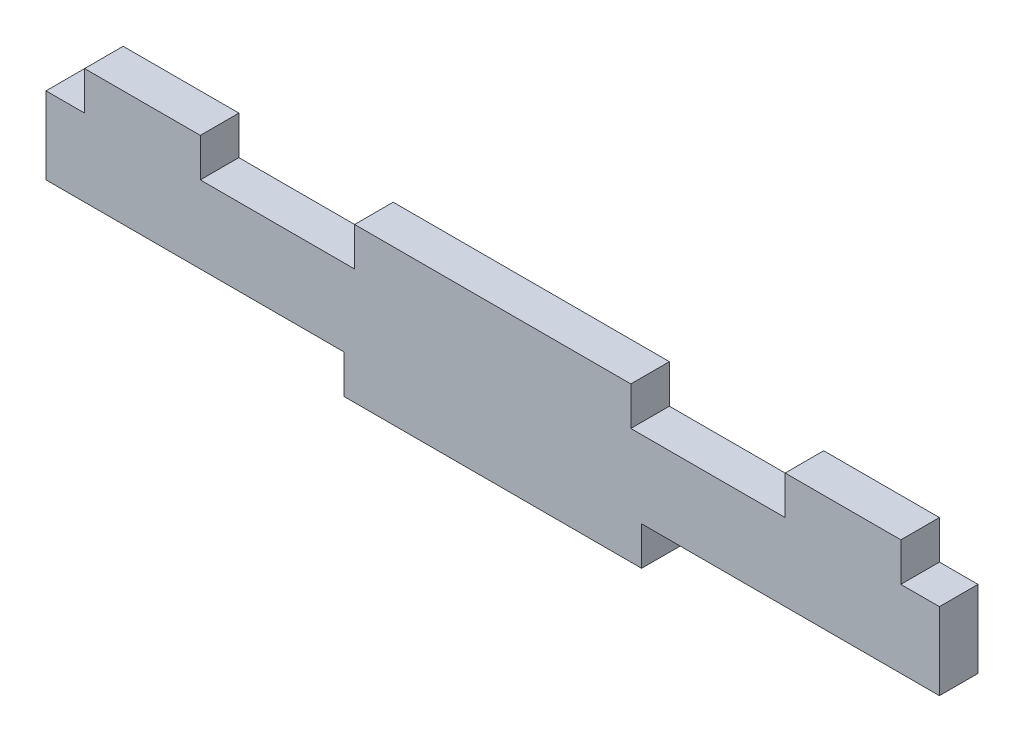
from build123d import *

# Parameters (mm, degrees)
SALIENTE_EXTRUIR1_DEPTH = 5


with BuildPart() as part:
    # Croquis1 → Saliente-Extruir1 (new body)
    with BuildSketch(Plane.XY):
        Polygon((5, 20), (20, 20), (20, 15), (40, 15), (40, 20), (75.8, 20), (75.8, 15), (95.8, 15), (95.8, 20), (110.8, 20), (110.8, 15), (115.8, 15), (115.8, 5), (110.8, 5), (77.2, 5), (77.2, 0), (38.6, 0), (38.6, 5), (5, 5), (0, 5), (0, 15), (5, 15), align=None)
    extrude(amount=SALIENTE_EXTRUIR1_DEPTH)


solid = part.part
